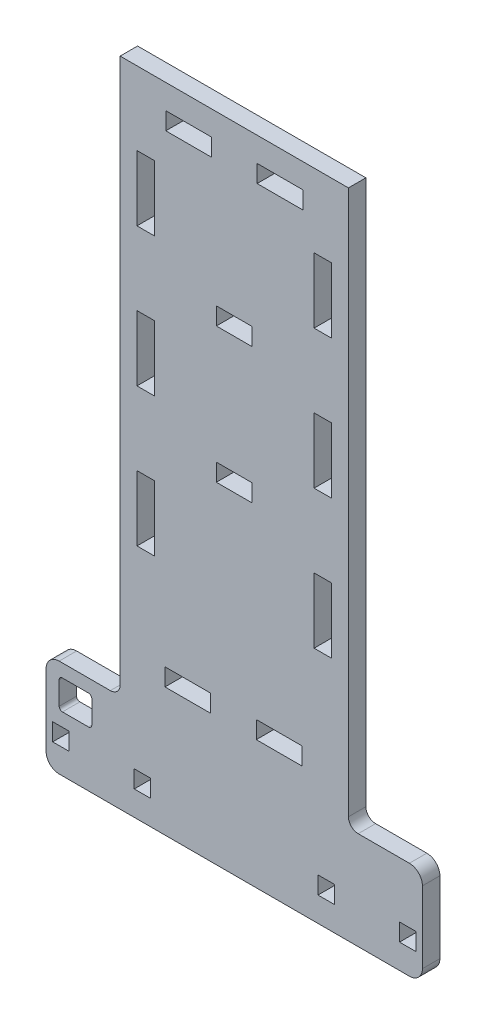
from build123d import *

# Parameters (mm, degrees)
MODEL_W             = 5.350000225
MODEL_H             = 20.000001416
MODEL_W_2           = 5.349997431
MODEL_W_3           = 11.000000872
MODEL_H_2           = 5.350001156
MODEL_H_3           = 19.999999553
MODEL_H_4           = 20.000003278
MODEL_W_4           = 13.99999857
MODEL_H_5           = 5.350008607
MODEL_W_5           = 14.000000433
MODEL_W_6           = 13.999999967
MODEL_H_6           = 5.350000225
MODEL_W_7           = 4.999999888
MODEL_H_7           = 5.349997431
MODEL_W_8           = 4.999998957
MODEL_W_9           = 5.000002682
BOSS_EXTRUDE1_DEPTH = 5.35


with BuildPart() as part:
    # Model → Boss-Extrude1 (new body)
    with BuildSketch(Plane.XY):
        with BuildLine():
            Line((4.000000656, 29.99999933), (19.694138318, 29.99999933))
            ThreePointArc((19.694138318, 29.99999933), (21.815457776, 30.878679471), (22.694136947, 32.999999329))
            Line((22.694136947, 32.999999329), (22.694136947, 199.99999553))
            Line((22.694136947, 199.99999553), (92.694137245, 199.99999553))
            Line((92.694137245, 199.99999553), (92.694137245, 32.999999821))
            ThreePointArc((92.694137245, 32.999999821), (93.572816728, 30.87867916), (95.694137245, 29.99999933))
            Line((95.694137245, 29.99999933), (111.388277918, 29.99999933))
            ThreePointArc((111.388277918, 29.99999933), (114.216704616, 28.828426881), (115.388277918, 26.000000537))
            Line((115.388277918, 26.000000537), (115.388277918, 4))
            ThreePointArc((115.388277918, 4), (114.216704811, 1.171572643), (111.388277262, 0))
            Line((111.388277262, 0), (4, 0))
            ThreePointArc((4, 0), (1.171572643, 1.171573107), (0, 4.000000656))
            Line((0, 4.000000656), (0, 25.99999933))
            ThreePointArc((0, 25.99999933), (1.171573107, 28.828426686), (4.000000656, 29.99999933))
        make_face()
        with Locations((84.849137348, 82.500000484)):
            Rectangle(MODEL_W, MODEL_H, mode=Mode.SUBTRACT)
        with Locations((30.539138243, 82.500000484)):
            Rectangle(MODEL_W_2, MODEL_H, mode=Mode.SUBTRACT)
        with Locations((57.694137562, 104.249998927)):
            Rectangle(MODEL_W_3, MODEL_H_2, mode=Mode.SUBTRACT)
        with Locations((84.849137348, 124.999998138)):
            Rectangle(MODEL_W, MODEL_H_3, mode=Mode.SUBTRACT)
        with Locations((30.539138243, 124.999998138)):
            Rectangle(MODEL_W_2, MODEL_H_3, mode=Mode.SUBTRACT)
        with Locations((30.539138243, 167.500000447)):
            Rectangle(MODEL_W_2, MODEL_H_4, mode=Mode.SUBTRACT)
        with Locations((84.849137348, 167.500000447)):
            Rectangle(MODEL_W, MODEL_H_4, mode=Mode.SUBTRACT)
        with Locations((57.694137562, 145.749997348)):
            Rectangle(MODEL_W_3, MODEL_H_2, mode=Mode.SUBTRACT)
        with Locations((43.694138527, 189.824998379)):
            Rectangle(MODEL_W_4, MODEL_H_5, mode=Mode.SUBTRACT)
        with Locations((71.694137529, 189.824998379)):
            Rectangle(MODEL_W_5, MODEL_H_5, mode=Mode.SUBTRACT)
        with Locations((71.444137721, 42.024999392)):
            Rectangle(MODEL_W_6, MODEL_H_6, mode=Mode.SUBTRACT)
        with Locations((43.44413802, 42.024999392)):
            Rectangle(MODEL_W_4, MODEL_H_6, mode=Mode.SUBTRACT)
        with Locations((85.869137663, 10.22499986)):
            Rectangle(MODEL_W_7, MODEL_H_7, mode=Mode.SUBTRACT)
        with Locations((110.869137571, 10.22499986)):
            Rectangle(MODEL_W_8, MODEL_H_7, mode=Mode.SUBTRACT)
        with Locations((4.519138485, 10.22499986)):
            Rectangle(MODEL_W_9, MODEL_H_7, mode=Mode.SUBTRACT)
        with Locations((29.519138858, 10.22499986)):
            Rectangle(MODEL_W_8, MODEL_H_7, mode=Mode.SUBTRACT)
        with BuildLine():
            Line((12.999996543, 17.000000924), (5.000000656, 17.000000924))
            ThreePointArc((5.000000656, 17.000000924), (4.292894475, 17.292893542), (4.000000656, 17.999999225))
            Line((4.000000656, 17.999999225), (4.000000656, 25.000000537))
            ThreePointArc((4.000000656, 25.000000537), (4.292891957, 25.7071054), (4.999995232, 26.000000536))
            Line((4.999995232, 26.000000536), (12.99999857, 26.000000536))
            ThreePointArc((12.99999857, 26.000000536), (13.707106067, 25.707106601), (13.99999857, 24.99999851))
            Line((13.99999857, 24.99999851), (13.99999857, 18.000000924))
            ThreePointArc((13.99999857, 18.000000924), (13.707104634, 17.292893426), (12.999996543, 17.000000924))
        make_face(mode=Mode.SUBTRACT)
    extrude(amount=BOSS_EXTRUDE1_DEPTH)


solid = part.part
